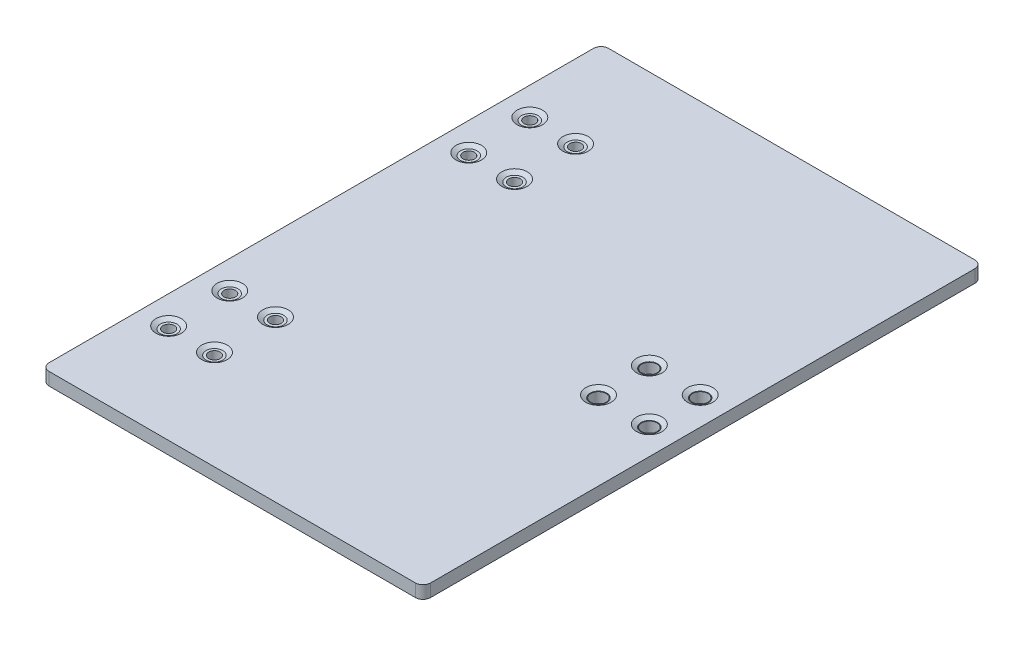
from build123d import *

# Parameters (mm, degrees)
SKETCH1_W                     = 150
SKETCH1_H                     = 220
BOSS_EXTRUDE1_DEPTH           = 5
SKETCH2_R                     = 2.25
SKETCH2_R_2                   = 3
CUT_EXTRUDE2_DEPTH            = 10
SKETCH3_R                     = 5
CUT_EXTRUDE3_DEPTH            = 1
CUT_EXTRUDE3_DRAFT            = -60
CUT_EXTRUDE3_PROFILE_2_DEPTH  = 1
CUT_EXTRUDE3_PROFILE_2_DRAFT  = -60
CUT_EXTRUDE3_PROFILE_3_DEPTH  = 1
CUT_EXTRUDE3_PROFILE_3_DRAFT  = -60
CUT_EXTRUDE3_PROFILE_4_DEPTH  = 1
CUT_EXTRUDE3_PROFILE_4_DRAFT  = -60
CUT_EXTRUDE3_PROFILE_5_DEPTH  = 1
CUT_EXTRUDE3_PROFILE_5_DRAFT  = -60
CUT_EXTRUDE3_PROFILE_6_DEPTH  = 1
CUT_EXTRUDE3_PROFILE_6_DRAFT  = -60
CUT_EXTRUDE3_PROFILE_7_DEPTH  = 1
CUT_EXTRUDE3_PROFILE_7_DRAFT  = -60
CUT_EXTRUDE3_PROFILE_8_DEPTH  = 1
CUT_EXTRUDE3_PROFILE_8_DRAFT  = -60
CUT_EXTRUDE3_PROFILE_9_DEPTH  = 1
CUT_EXTRUDE3_PROFILE_9_DRAFT  = -60
CUT_EXTRUDE3_PROFILE_10_DEPTH = 1
CUT_EXTRUDE3_PROFILE_10_DRAFT = -60
CUT_EXTRUDE3_PROFILE_11_DEPTH = 1
CUT_EXTRUDE3_PROFILE_11_DRAFT = -60
CUT_EXTRUDE3_PROFILE_12_DEPTH = 1
CUT_EXTRUDE3_PROFILE_12_DRAFT = -60
FILLET1_R                     = 3


with BuildPart() as part:
    # Sketch1 → Boss-Extrude1 (new body)
    with BuildSketch(Plane(origin=(0, 0, 0), x_dir=(1, 0, 0), z_dir=(0, 1, 0))):
        with Locations((75, 110)):
            Rectangle(SKETCH1_W, SKETCH1_H)
    extrude(amount=-BOSS_EXTRUDE1_DEPTH)

    # Sketch2 → Cut-Extrude2 (cut)
    with BuildSketch(Plane(origin=(0, 0, 0), x_dir=(1, 0, 0), z_dir=(0, 1, 0))):
        with Locations(Location((11, 181, 0), (0, 0, 270))):
            Circle(SKETCH2_R)
        with Locations(Location((11, 157, 0), (0, 0, 270))):
            Circle(SKETCH2_R)
        with Locations(Location((29, 157, 0), (0, 0, 270))):
            Circle(SKETCH2_R)
        with Locations(Location((29, 181, 0), (0, 0, 270))):
            Circle(SKETCH2_R)
        with Locations(Location((11, 63, 0), (0, 0, 270))):
            Circle(SKETCH2_R)
        with Locations(Location((29, 63, 0), (0, 0, 270))):
            Circle(SKETCH2_R)
        with Locations(Location((11, 39, 0), (0, 0, 270))):
            Circle(SKETCH2_R)
        with Locations(Location((29, 39, 0), (0, 0, 270))):
            Circle(SKETCH2_R)
        with Locations(Location((119, 120, 0), (0, 0, 270))):
            Circle(SKETCH2_R_2)
        with Locations(Location((139, 120, 0), (0, 0, 270))):
            Circle(SKETCH2_R_2)
        with Locations(Location((119, 100, 0), (0, 0, 270))):
            Circle(SKETCH2_R_2)
        with Locations(Location((139, 100, 0), (0, 0, 270))):
            Circle(SKETCH2_R_2)
    extrude(amount=-CUT_EXTRUDE2_DEPTH, mode=Mode.SUBTRACT)


with BuildPart() as cut_extrude3_tool:
    # Sketch3 → Cut-Extrude3 (with draft: the straight prism first)
    with BuildSketch(Plane(origin=(0, 0, 0), x_dir=(1, 0, 0), z_dir=(0, 1, 0))):
        with Locations((11, 181)):
            Circle(SKETCH3_R)
    extrude(amount=-CUT_EXTRUDE3_DEPTH)
    # Cut-Extrude3: the draft: its side faces are tilted about the plane it starts from
    cut_extrude3_sides = [cut_extrude3_tool.faces().sort_by_distance(p)[0] for p in [
        (6, -0.5, -181),
    ]]
    draft(cut_extrude3_sides, Plane(origin=(0, 0, 0), x_dir=(1, 0, 0), z_dir=(0, 1, 0)), CUT_EXTRUDE3_DRAFT)


with BuildPart() as part_1:
    add(part.part)

    # Cut-Extrude3: cut by cut_extrude3_tool
    add(cut_extrude3_tool.part, mode=Mode.SUBTRACT)


with BuildPart() as cut_extrude3_profile_2_tool:
    # Sketch3 → Cut-Extrude3 profile 2 (with draft: the straight prism first)
    with BuildSketch(Plane(origin=(0, 0, 0), x_dir=(1, 0, 0), z_dir=(0, 1, 0))):
        with Locations((29, 181)):
            Circle(SKETCH3_R)
    extrude(amount=-CUT_EXTRUDE3_PROFILE_2_DEPTH)
    # Cut-Extrude3 profile 2: the draft: its side faces are tilted about the plane it starts from
    cut_extrude3_profile_2_sides = [cut_extrude3_profile_2_tool.faces().sort_by_distance(p)[0] for p in [
        (24, -0.5, -181),
    ]]
    draft(cut_extrude3_profile_2_sides, Plane(origin=(0, 0, 0), x_dir=(1, 0, 0), z_dir=(0, 1, 0)), CUT_EXTRUDE3_PROFILE_2_DRAFT)


with BuildPart() as part_2:
    add(part_1.part)

    # Cut-Extrude3 profile 2: cut by cut_extrude3_profile_2_tool
    add(cut_extrude3_profile_2_tool.part, mode=Mode.SUBTRACT)


with BuildPart() as cut_extrude3_profile_3_tool:
    # Sketch3 → Cut-Extrude3 profile 3 (with draft: the straight prism first)
    with BuildSketch(Plane(origin=(0, 0, 0), x_dir=(1, 0, 0), z_dir=(0, 1, 0))):
        with Locations((11, 157)):
            Circle(SKETCH3_R)
    extrude(amount=-CUT_EXTRUDE3_PROFILE_3_DEPTH)
    # Cut-Extrude3 profile 3: the draft: its side faces are tilted about the plane it starts from
    cut_extrude3_profile_3_sides = [cut_extrude3_profile_3_tool.faces().sort_by_distance(p)[0] for p in [
        (6, -0.5, -157),
    ]]
    draft(cut_extrude3_profile_3_sides, Plane(origin=(0, 0, 0), x_dir=(1, 0, 0), z_dir=(0, 1, 0)), CUT_EXTRUDE3_PROFILE_3_DRAFT)


with BuildPart() as part_3:
    add(part_2.part)

    # Cut-Extrude3 profile 3: cut by cut_extrude3_profile_3_tool
    add(cut_extrude3_profile_3_tool.part, mode=Mode.SUBTRACT)


with BuildPart() as cut_extrude3_profile_4_tool:
    # Sketch3 → Cut-Extrude3 profile 4 (with draft: the straight prism first)
    with BuildSketch(Plane(origin=(0, 0, 0), x_dir=(1, 0, 0), z_dir=(0, 1, 0))):
        with Locations((29, 157)):
            Circle(SKETCH3_R)
    extrude(amount=-CUT_EXTRUDE3_PROFILE_4_DEPTH)
    # Cut-Extrude3 profile 4: the draft: its side faces are tilted about the plane it starts from
    cut_extrude3_profile_4_sides = [cut_extrude3_profile_4_tool.faces().sort_by_distance(p)[0] for p in [
        (24, -0.5, -157),
    ]]
    draft(cut_extrude3_profile_4_sides, Plane(origin=(0, 0, 0), x_dir=(1, 0, 0), z_dir=(0, 1, 0)), CUT_EXTRUDE3_PROFILE_4_DRAFT)


with BuildPart() as part_4:
    add(part_3.part)

    # Cut-Extrude3 profile 4: cut by cut_extrude3_profile_4_tool
    add(cut_extrude3_profile_4_tool.part, mode=Mode.SUBTRACT)


with BuildPart() as cut_extrude3_profile_5_tool:
    # Sketch3 → Cut-Extrude3 profile 5 (with draft: the straight prism first)
    with BuildSketch(Plane(origin=(0, 0, 0), x_dir=(1, 0, 0), z_dir=(0, 1, 0))):
        with Locations((119, 120)):
            Circle(SKETCH3_R)
    extrude(amount=-CUT_EXTRUDE3_PROFILE_5_DEPTH)
    # Cut-Extrude3 profile 5: the draft: its side faces are tilted about the plane it starts from
    cut_extrude3_profile_5_sides = [cut_extrude3_profile_5_tool.faces().sort_by_distance(p)[0] for p in [
        (114, -0.5, -120),
    ]]
    draft(cut_extrude3_profile_5_sides, Plane(origin=(0, 0, 0), x_dir=(1, 0, 0), z_dir=(0, 1, 0)), CUT_EXTRUDE3_PROFILE_5_DRAFT)


with BuildPart() as part_5:
    add(part_4.part)

    # Cut-Extrude3 profile 5: cut by cut_extrude3_profile_5_tool
    add(cut_extrude3_profile_5_tool.part, mode=Mode.SUBTRACT)


with BuildPart() as cut_extrude3_profile_6_tool:
    # Sketch3 → Cut-Extrude3 profile 6 (with draft: the straight prism first)
    with BuildSketch(Plane(origin=(0, 0, 0), x_dir=(1, 0, 0), z_dir=(0, 1, 0))):
        with Locations((139, 120)):
            Circle(SKETCH3_R)
    extrude(amount=-CUT_EXTRUDE3_PROFILE_6_DEPTH)
    # Cut-Extrude3 profile 6: the draft: its side faces are tilted about the plane it starts from
    cut_extrude3_profile_6_sides = [cut_extrude3_profile_6_tool.faces().sort_by_distance(p)[0] for p in [
        (134, -0.5, -120),
    ]]
    draft(cut_extrude3_profile_6_sides, Plane(origin=(0, 0, 0), x_dir=(1, 0, 0), z_dir=(0, 1, 0)), CUT_EXTRUDE3_PROFILE_6_DRAFT)


with BuildPart() as part_6:
    add(part_5.part)

    # Cut-Extrude3 profile 6: cut by cut_extrude3_profile_6_tool
    add(cut_extrude3_profile_6_tool.part, mode=Mode.SUBTRACT)


with BuildPart() as cut_extrude3_profile_7_tool:
    # Sketch3 → Cut-Extrude3 profile 7 (with draft: the straight prism first)
    with BuildSketch(Plane(origin=(0, 0, 0), x_dir=(1, 0, 0), z_dir=(0, 1, 0))):
        with Locations((119, 100)):
            Circle(SKETCH3_R)
    extrude(amount=-CUT_EXTRUDE3_PROFILE_7_DEPTH)
    # Cut-Extrude3 profile 7: the draft: its side faces are tilted about the plane it starts from
    cut_extrude3_profile_7_sides = [cut_extrude3_profile_7_tool.faces().sort_by_distance(p)[0] for p in [
        (114, -0.5, -100),
    ]]
    draft(cut_extrude3_profile_7_sides, Plane(origin=(0, 0, 0), x_dir=(1, 0, 0), z_dir=(0, 1, 0)), CUT_EXTRUDE3_PROFILE_7_DRAFT)


with BuildPart() as part_7:
    add(part_6.part)

    # Cut-Extrude3 profile 7: cut by cut_extrude3_profile_7_tool
    add(cut_extrude3_profile_7_tool.part, mode=Mode.SUBTRACT)


with BuildPart() as cut_extrude3_profile_8_tool:
    # Sketch3 → Cut-Extrude3 profile 8 (with draft: the straight prism first)
    with BuildSketch(Plane(origin=(0, 0, 0), x_dir=(1, 0, 0), z_dir=(0, 1, 0))):
        with Locations((139, 100)):
            Circle(SKETCH3_R)
    extrude(amount=-CUT_EXTRUDE3_PROFILE_8_DEPTH)
    # Cut-Extrude3 profile 8: the draft: its side faces are tilted about the plane it starts from
    cut_extrude3_profile_8_sides = [cut_extrude3_profile_8_tool.faces().sort_by_distance(p)[0] for p in [
        (134, -0.5, -100),
    ]]
    draft(cut_extrude3_profile_8_sides, Plane(origin=(0, 0, 0), x_dir=(1, 0, 0), z_dir=(0, 1, 0)), CUT_EXTRUDE3_PROFILE_8_DRAFT)


with BuildPart() as part_8:
    add(part_7.part)

    # Cut-Extrude3 profile 8: cut by cut_extrude3_profile_8_tool
    add(cut_extrude3_profile_8_tool.part, mode=Mode.SUBTRACT)


with BuildPart() as cut_extrude3_profile_9_tool:
    # Sketch3 → Cut-Extrude3 profile 9 (with draft: the straight prism first)
    with BuildSketch(Plane(origin=(0, 0, 0), x_dir=(1, 0, 0), z_dir=(0, 1, 0))):
        with Locations((29, 63)):
            Circle(SKETCH3_R)
    extrude(amount=-CUT_EXTRUDE3_PROFILE_9_DEPTH)
    # Cut-Extrude3 profile 9: the draft: its side faces are tilted about the plane it starts from
    cut_extrude3_profile_9_sides = [cut_extrude3_profile_9_tool.faces().sort_by_distance(p)[0] for p in [
        (24, -0.5, -63),
    ]]
    draft(cut_extrude3_profile_9_sides, Plane(origin=(0, 0, 0), x_dir=(1, 0, 0), z_dir=(0, 1, 0)), CUT_EXTRUDE3_PROFILE_9_DRAFT)


with BuildPart() as part_9:
    add(part_8.part)

    # Cut-Extrude3 profile 9: cut by cut_extrude3_profile_9_tool
    add(cut_extrude3_profile_9_tool.part, mode=Mode.SUBTRACT)


with BuildPart() as cut_extrude3_profile_10_tool:
    # Sketch3 → Cut-Extrude3 profile 10 (with draft: the straight prism first)
    with BuildSketch(Plane(origin=(0, 0, 0), x_dir=(1, 0, 0), z_dir=(0, 1, 0))):
        with Locations((11, 63)):
            Circle(SKETCH3_R)
    extrude(amount=-CUT_EXTRUDE3_PROFILE_10_DEPTH)
    # Cut-Extrude3 profile 10: the draft: its side faces are tilted about the plane it starts from
    cut_extrude3_profile_10_sides = [cut_extrude3_profile_10_tool.faces().sort_by_distance(p)[0] for p in [
        (6, -0.5, -63),
    ]]
    draft(cut_extrude3_profile_10_sides, Plane(origin=(0, 0, 0), x_dir=(1, 0, 0), z_dir=(0, 1, 0)), CUT_EXTRUDE3_PROFILE_10_DRAFT)


with BuildPart() as part_10:
    add(part_9.part)

    # Cut-Extrude3 profile 10: cut by cut_extrude3_profile_10_tool
    add(cut_extrude3_profile_10_tool.part, mode=Mode.SUBTRACT)


with BuildPart() as cut_extrude3_profile_11_tool:
    # Sketch3 → Cut-Extrude3 profile 11 (with draft: the straight prism first)
    with BuildSketch(Plane(origin=(0, 0, 0), x_dir=(1, 0, 0), z_dir=(0, 1, 0))):
        with Locations((11, 39)):
            Circle(SKETCH3_R)
    extrude(amount=-CUT_EXTRUDE3_PROFILE_11_DEPTH)
    # Cut-Extrude3 profile 11: the draft: its side faces are tilted about the plane it starts from
    cut_extrude3_profile_11_sides = [cut_extrude3_profile_11_tool.faces().sort_by_distance(p)[0] for p in [
        (6, -0.5, -39),
    ]]
    draft(cut_extrude3_profile_11_sides, Plane(origin=(0, 0, 0), x_dir=(1, 0, 0), z_dir=(0, 1, 0)), CUT_EXTRUDE3_PROFILE_11_DRAFT)


with BuildPart() as part_11:
    add(part_10.part)

    # Cut-Extrude3 profile 11: cut by cut_extrude3_profile_11_tool
    add(cut_extrude3_profile_11_tool.part, mode=Mode.SUBTRACT)


with BuildPart() as cut_extrude3_profile_12_tool:
    # Sketch3 → Cut-Extrude3 profile 12 (with draft: the straight prism first)
    with BuildSketch(Plane(origin=(0, 0, 0), x_dir=(1, 0, 0), z_dir=(0, 1, 0))):
        with Locations((29, 39)):
            Circle(SKETCH3_R)
    extrude(amount=-CUT_EXTRUDE3_PROFILE_12_DEPTH)
    # Cut-Extrude3 profile 12: the draft: its side faces are tilted about the plane it starts from
    cut_extrude3_profile_12_sides = [cut_extrude3_profile_12_tool.faces().sort_by_distance(p)[0] for p in [
        (24, -0.5, -39),
    ]]
    draft(cut_extrude3_profile_12_sides, Plane(origin=(0, 0, 0), x_dir=(1, 0, 0), z_dir=(0, 1, 0)), CUT_EXTRUDE3_PROFILE_12_DRAFT)


with BuildPart() as part_12:
    add(part_11.part)

    # Cut-Extrude3 profile 12: cut by cut_extrude3_profile_12_tool
    add(cut_extrude3_profile_12_tool.part, mode=Mode.SUBTRACT)

    # Fillet1
    fillet1_edges = [part_12.edges().sort_by_distance(p)[0] for p in [
        (150, -2.5, -220),
        (150, -2.5, 0),
        (0, -2.5, 0),
        (0, -2.5, -220),
    ]]
    fillet(fillet1_edges, radius=FILLET1_R)


solid = part_12.part
